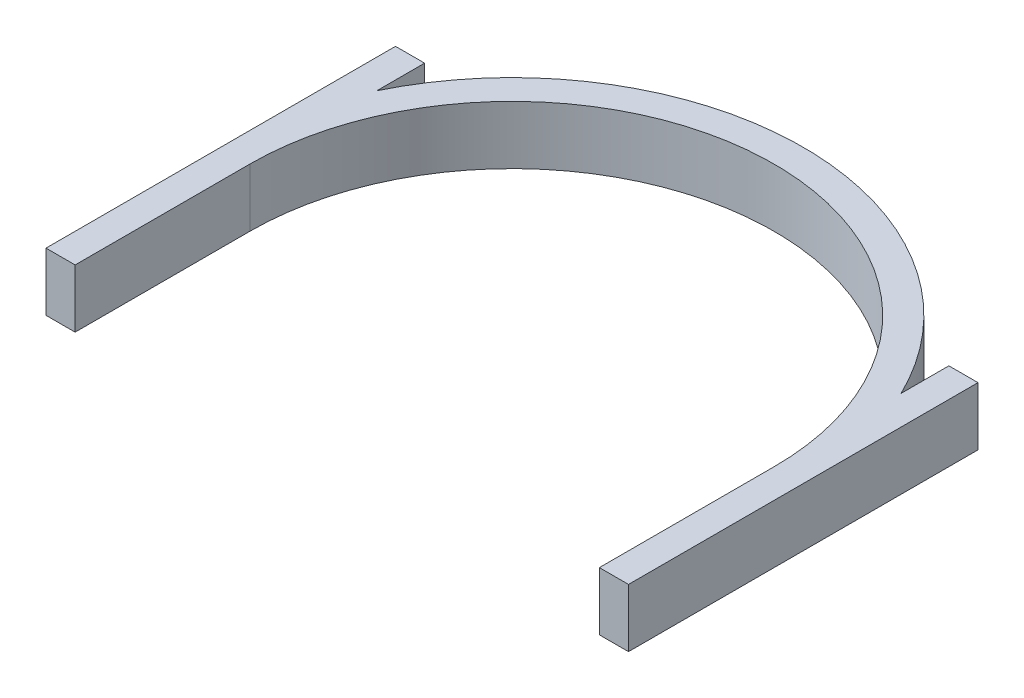
from build123d import *

# Parameters (mm, degrees)
EXTRUDE_1_DEPTH = 10


with BuildPart() as part:
    # 草图1 → 凸台-拉伸1 (new body)
    with BuildSketch(Plane(origin=(0, 0, 0), x_dir=(1, 0, 0), z_dir=(0, 1, 0))):
        with BuildLine():
            Line((-45, 0), (-45, -30))
            Line((-45, -30), (-50, -30))
            Line((-50, -30), (-50, 30))
            Line((-50, 30), (-45, 30))
            Line((-45, 30), (-45, 21.794494718))
            ThreePointArc((-45, 21.794494718), (0, 50), (45, 21.794494718))
            Line((45, 21.794494718), (45, 30))
            Line((45, 30), (50, 30))
            Line((50, 30), (50, -30))
            Line((50, -30), (45, -30))
            Line((45, -30), (45, 0))
            ThreePointArc((45, 0), (0, 45), (-45, 0))
        make_face()
    extrude(amount=EXTRUDE_1_DEPTH)


solid = part.part
